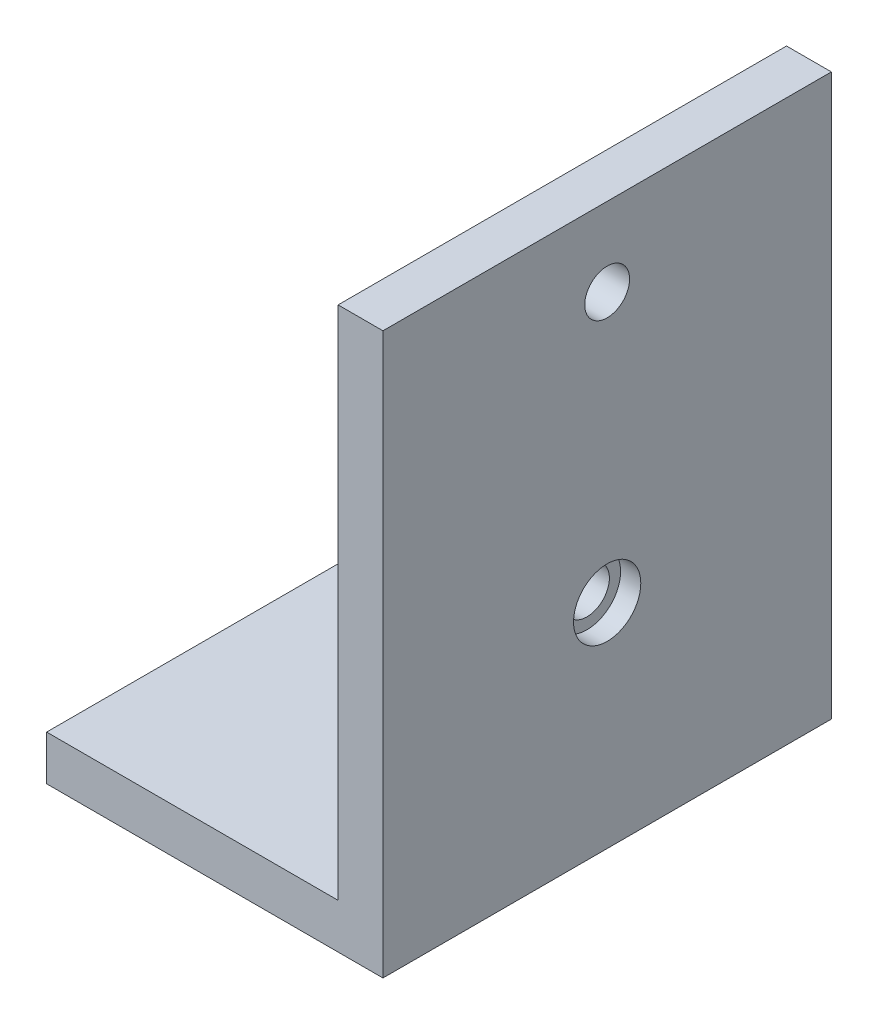
from build123d import *

# Parameters (mm, degrees)
EXTRUIR_L_MINA1_DEPTH = 100
CROQUIS2_R            = 5
CORTAR_EXTRUIR1_DEPTH = 10
CROQUIS3_R            = 7.5
CORTAR_EXTRUIR2_DEPTH = 4.5


with BuildPart() as part:
    # Croquis1 → Extruir-Lámina1 (new body)
    with BuildSketch(Plane.XY):
        Polygon((0, 125), (0, 0), (-75, 0), (-75, 10), (-10, 10), (-10, 125), align=None)
    extrude(amount=EXTRUIR_L_MINA1_DEPTH)

    # Croquis2 → Cortar-Extruir1 (cut)
    with BuildSketch(Plane(origin=(0, 0, 0), x_dir=(0, 0, -1), z_dir=(1, 0, 0))):
        with Locations((-50, 107.5)):
            Circle(CROQUIS2_R)
        with Locations((-50, 47.5)):
            Circle(CROQUIS2_R)
    extrude(amount=-CORTAR_EXTRUIR1_DEPTH, mode=Mode.SUBTRACT)

    # Croquis3 → Cortar-Extruir2 (cut)
    with BuildSketch(Plane(origin=(0, 0, 0), x_dir=(0, 0, -1), z_dir=(1, 0, 0))):
        with Locations((-50, 47.5)):
            Circle(CROQUIS3_R)
    extrude(amount=-CORTAR_EXTRUIR2_DEPTH, mode=Mode.SUBTRACT)


solid = part.part
